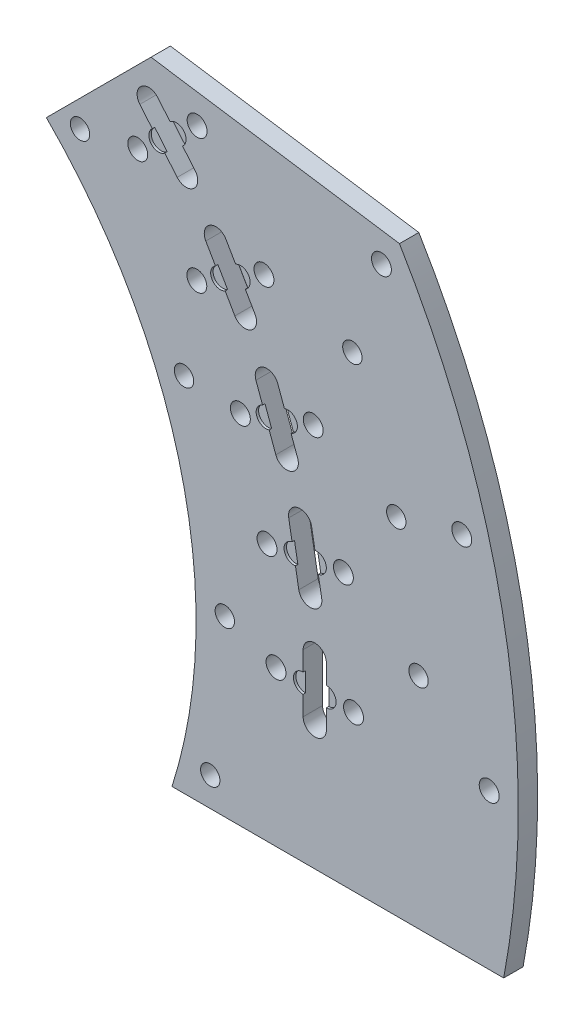
from build123d import *

# Parameters (mm, degrees)
SKETCH1_R           = 3.175
SKETCH1_R_2         = 3.2639
BOSS_EXTRUDE1_DEPTH = 6.35
SKETCH2_R           = 3.175
CUT_EXTRUDE1_DEPTH  = 0.79375


with BuildPart() as part:
    # Sketch1 → Boss-Extrude1 (new body)
    with BuildSketch(Plane.XY):
        with BuildLine():
            Line((159.591131024, -50.8), (268.282803213, -50.8))
            ThreePointArc((268.282803213, -50.8), (268.798556268, 47.996235774), (234.123018172, 140.508771477))
            Line((234.123018172, 140.508771477), (152.715190262, 152.715190262))
            Line((152.715190262, 152.715190262), (118.427127597, 118.427127597))
            ThreePointArc((118.427127597, 118.427127597), (154.732498954, 64.092299607), (167.48125, 0))
            ThreePointArc((167.48125, 0), (165.496965553, -25.70454229), (159.591131024, -50.8))
        make_face()
        with Locations((176.898422575, 6.177429038)):
            Circle(SKETCH1_R, mode=Mode.SUBTRACT)
        with Locations((129.454176147, 120.717972221)):
            Circle(SKETCH1_R, mode=Mode.SUBTRACT)
        with Locations((163.532451502, 67.7373593)):
            Circle(SKETCH1_R, mode=Mode.SUBTRACT)
        with Locations((172.12665951, -41.275)):
            Circle(SKETCH1_R, mode=Mode.SUBTRACT)
        with Locations((193.675, 0)):
            Circle(SKETCH1_R_2, mode=Mode.SUBTRACT)
        with Locations((219.075, 0)):
            Circle(SKETCH1_R_2, mode=Mode.SUBTRACT)
        with Locations((215.746758491, 38.041974522)):
            Circle(SKETCH1_R_2, mode=Mode.SUBTRACT)
        with Locations((190.732641565, 33.63131081)):
            Circle(SKETCH1_R_2, mode=Mode.SUBTRACT)
        with Locations((205.863160899, 74.928062899)):
            Circle(SKETCH1_R_2, mode=Mode.SUBTRACT)
        with Locations((181.994968331, 66.240751259)):
            Circle(SKETCH1_R_2, mode=Mode.SUBTRACT)
        with Locations((189.724515334, 109.5375)):
            Circle(SKETCH1_R_2, mode=Mode.SUBTRACT)
        with Locations((167.727470078, 96.8375)):
            Circle(SKETCH1_R_2, mode=Mode.SUBTRACT)
        with Locations((167.821186376, 140.818695592)):
            Circle(SKETCH1_R_2, mode=Mode.SUBTRACT)
        with Locations((148.363657521, 124.491890306)):
            Circle(SKETCH1_R_2, mode=Mode.SUBTRACT)
        with Locations((263.525, 0)):
            Circle(SKETCH1_R_2, mode=Mode.SUBTRACT)
        with Locations((254.545603373, 68.205288861)):
            Circle(SKETCH1_R_2, mode=Mode.SUBTRACT)
        with Locations((228.219344532, 131.7625)):
            Circle(SKETCH1_R_2, mode=Mode.SUBTRACT)
        with Locations((240.38178065, 21.030680725)):
            Circle(SKETCH1_R, mode=Mode.SUBTRACT)
        with Locations((233.077901884, 62.453035583)):
            Circle(SKETCH1_R, mode=Mode.SUBTRACT)
        with Locations((218.692069012, 101.977786558)):
            Circle(SKETCH1_R, mode=Mode.SUBTRACT)
        with BuildLine():
            Line((202.565, 0), (202.565, 9.525))
            ThreePointArc((202.565, 9.525), (206.375, 13.335), (210.185, 9.525))
            Line((210.185, 9.525), (210.185, 0))
            Line((210.185, 0), (210.185, -9.525))
            ThreePointArc((210.185, -9.525), (206.375, -13.335), (202.565, -9.525))
            Line((202.565, -9.525), (202.565, 0))
        make_face(mode=Mode.SUBTRACT)
        with BuildLine():
            Line((199.487582489, 35.175043109), (201.141581381, 25.794749262))
            ThreePointArc((201.141581381, 25.794749262), (205.555298477, 22.70423128), (208.645816459, 27.117948375))
            Line((208.645816459, 27.117948375), (206.991817567, 36.498242223))
            Line((206.991817567, 36.498242223), (205.337818675, 45.87853607))
            ThreePointArc((205.337818675, 45.87853607), (200.924101579, 48.969054052), (197.833583597, 44.555336957))
            Line((197.833583597, 44.555336957), (199.487582489, 35.175043109))
        make_face(mode=Mode.SUBTRACT)
        with BuildLine():
            Line((190.348835729, 69.281310333), (193.606577595, 60.33073812))
            ThreePointArc((193.606577595, 60.33073812), (198.489903226, 58.053605981), (200.767035365, 62.936931612))
            Line((200.767035365, 62.936931612), (197.5092935, 71.887503825))
            Line((197.5092935, 71.887503825), (194.251551635, 80.838076038))
            ThreePointArc((194.251551635, 80.838076038), (189.368226003, 83.115208177), (187.091093864, 78.231882546))
            Line((187.091093864, 78.231882546), (190.348835729, 69.281310333))
        make_face(mode=Mode.SUBTRACT)
        with BuildLine():
            Line((175.426435918, 101.2825), (180.188935918, 93.033608029))
            ThreePointArc((180.188935918, 93.033608029), (185.393492706, 91.639051241), (186.788049494, 96.843608029))
            Line((186.788049494, 96.843608029), (182.025549494, 105.0925))
            Line((182.025549494, 105.0925), (177.263049494, 113.341391971))
            ThreePointArc((177.263049494, 113.341391971), (172.058492706, 114.735948759), (170.663935918, 109.531391971))
            Line((170.663935918, 109.531391971), (175.426435918, 101.2825))
        make_face(mode=Mode.SUBTRACT)
        with BuildLine():
            Line((155.17379262, 130.206272156), (161.296344603, 122.909698835))
            ThreePointArc((161.296344603, 122.909698835), (166.663994724, 122.4400903), (167.133603259, 127.807740421))
            Line((167.133603259, 127.807740421), (161.011051277, 135.104313742))
            Line((161.011051277, 135.104313742), (154.888499295, 142.400887063))
            ThreePointArc((154.888499295, 142.400887063), (149.520849174, 142.870495598), (149.051240638, 137.502845477))
            Line((149.051240638, 137.502845477), (155.17379262, 130.206272156))
        make_face(mode=Mode.SUBTRACT)
    extrude(amount=BOSS_EXTRUDE1_DEPTH)

    # Sketch2 → Cut-Extrude1 (cut)
    with BuildSketch(Plane.XY.offset(6.35)):
        with Locations((202.565, 0)):
            Circle(SKETCH2_R)
        with Locations((210.185, 0)):
            Circle(SKETCH2_R)
        with Locations((199.487582489, 35.175043109)):
            Circle(SKETCH2_R)
        with Locations((206.991817567, 36.498242223)):
            Circle(SKETCH2_R)
        with Locations((190.348835729, 69.281310333)):
            Circle(SKETCH2_R)
        with Locations((197.5092935, 71.887503825)):
            Circle(SKETCH2_R)
        with Locations((175.426435918, 101.2825)):
            Circle(SKETCH2_R)
        with Locations((182.025549494, 105.0925)):
            Circle(SKETCH2_R)
        with Locations((155.17379262, 130.206272156)):
            Circle(SKETCH2_R)
        with Locations((161.011051277, 135.104313742)):
            Circle(SKETCH2_R)
    extrude(amount=-CUT_EXTRUDE1_DEPTH, mode=Mode.SUBTRACT)


solid = part.part
